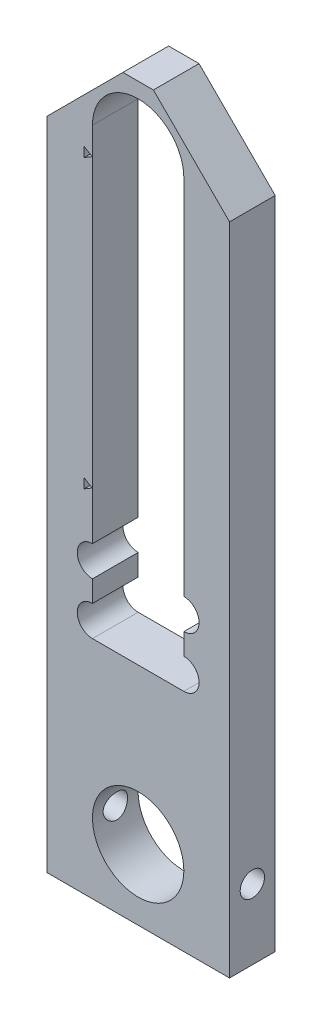
from build123d import *

# Parameters (mm, degrees)
BASE_EXTRUSION_DEPTH       = 15
ESQUISSE2_R                = 15
ENL_V_MAT_EXTRU_1_DEPTH    = 15
ENL_V_MAT_EXTRU_2_DEPTH    = 15
ESQUISSE4_R                = 4
ENL_V_MAT_EXTRU_3_DEPTH    = 248.840674628
ENL_V_MAT_EXTRU_4_DEPTH    = 248.840674658
R_P_TITION_LIN_AIRE1_COUNT = 2
R_P_TITION_LIN_AIRE1_PITCH = 94.21


with BuildPart() as part:
    # Esquisse1 → Base-Extrusion (new body)
    with BuildSketch(Plane.XY):
        Polygon((0, 215), (25, 240), (35, 240), (60, 215), (60, 0), (0, 0), align=None)
    extrude(amount=BASE_EXTRUSION_DEPTH)

    # Esquisse2 → Enlèv. mat.-Extru.1 (cut)
    with BuildSketch(Plane.XY.offset(15)):
        with Locations((30, 23)):
            Circle(ESQUISSE2_R)
    extrude(amount=-ENL_V_MAT_EXTRU_1_DEPTH, mode=Mode.SUBTRACT)

    # Esquisse3 → Enlèv. mat.-Extru.2 (cut)
    with BuildSketch(Plane.XY.offset(15)):
        with BuildLine():
            Line((45, 91), (45, 84))
            ThreePointArc((45, 84), (50, 79), (45, 74))
            Line((45, 74), (15, 74))
            ThreePointArc((15, 74), (10, 79), (15, 84))
            Line((15, 84), (15, 91))
            ThreePointArc((15, 91), (10, 96), (15, 101))
            Line((15, 101), (15, 220))
            ThreePointArc((15, 220), (30, 235), (45, 220))
            Line((45, 220), (45, 101))
            ThreePointArc((45, 101), (50, 96), (45, 91))
        make_face()
    extrude(amount=-ENL_V_MAT_EXTRU_2_DEPTH, mode=Mode.SUBTRACT)

    # Esquisse4 → Enlèv. mat.-Extru.3 (cut, through all)
    with BuildSketch(Plane.ZY):
        with Locations((7.5, 23)):
            Circle(ESQUISSE4_R)
    extrude(amount=-ENL_V_MAT_EXTRU_3_DEPTH, mode=Mode.SUBTRACT)

    # Esquisse5 → Enlèv. mat.-Extru.4 (cut, through all)
    with BuildSketch(Plane.XY.offset(15)):
        Polygon((14.902218658, 116.777944848), (12.23927057, 118.377944848), (12.23927057, 115.177944848), align=None)
    enl_v_mat_extru_4 = extrude(amount=-ENL_V_MAT_EXTRU_4_DEPTH, mode=Mode.SUBTRACT)

    # Répétition linéaire1: Enlèv. mat.-Extru.4 ×2
    with Locations(*[(0, i * R_P_TITION_LIN_AIRE1_PITCH, 0) for i in range(1, R_P_TITION_LIN_AIRE1_COUNT)]):
        add(enl_v_mat_extru_4, mode=Mode.SUBTRACT)


solid = part.part
